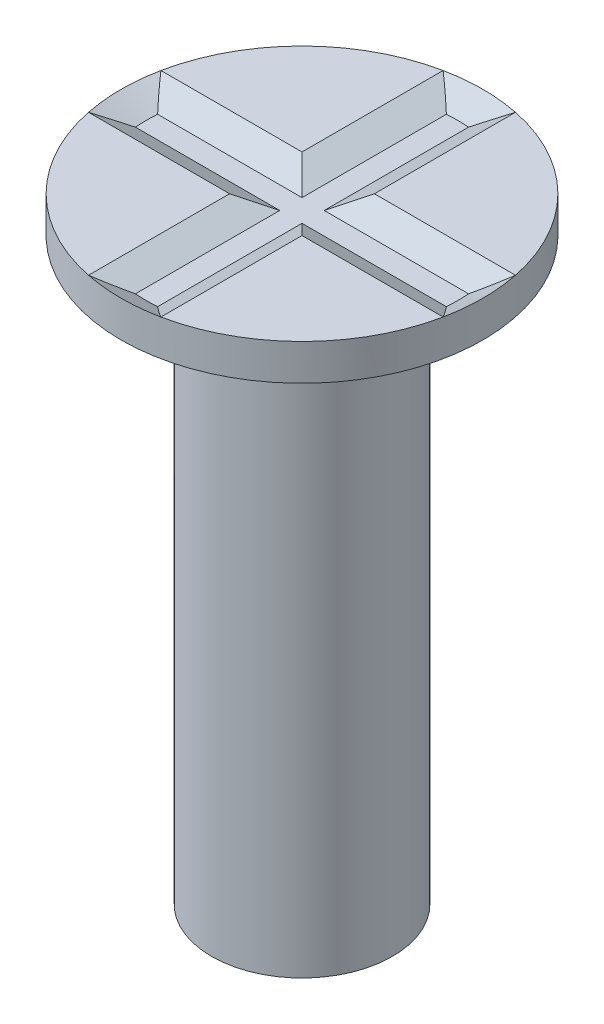
from build123d import *

# Parameters (mm, degrees)
SKETCH1_R           = 0.5
BOSS_EXTRUDE1_DEPTH = 0.1
BOSS_EXTRUDE2_START = -0.1
SKETCH1_3_R         = 0.25
BOSS_EXTRUDE2_DEPTH = 1.6
CUT_EXTRUDE1_DEPTH  = 0.04
CUT_EXTRUDE1_TAPER  = 60


with BuildPart() as part:
    # Sketch1 → Boss-Extrude1 (new body)
    with BuildSketch(Plane(origin=(0, 0, 0), x_dir=(1, 0, 0), z_dir=(0, 1, 0))):
        with Locations(Location((0, 0, 0), (0, 0, 270))):
            Circle(SKETCH1_R)
    extrude(amount=-BOSS_EXTRUDE1_DEPTH)

    # Sketch1<3> → Boss-Extrude2 (add)
    with BuildSketch(Plane(origin=(0, 0, 0), x_dir=(1, 0, 0), z_dir=(0, 1, 0)).offset(BOSS_EXTRUDE2_START)):
        with Locations(Location((0, 0, 0), (0, 0, 270))):
            Circle(SKETCH1_3_R)
    extrude(amount=-BOSS_EXTRUDE2_DEPTH)

    # Sketch2 → Cut-Extrude1 (cut)
    with BuildSketch(Plane(origin=(0, 0, 0), x_dir=(1, 0, 0), z_dir=(0, 1, 0))):
        with BuildLine():
            ThreePointArc((0.1, 0.489897949), (0, 0.5), (-0.1, 0.489897949))
            Line((-0.1, 0.489897949), (-0.1, 0.1))
            Line((-0.1, 0.1), (-0.489897949, 0.1))
            ThreePointArc((-0.489897949, 0.1), (-0.5, 0), (-0.489897949, -0.1))
            Line((-0.489897949, -0.1), (-0.1, -0.1))
            Line((-0.1, -0.1), (-0.1, -0.489897949))
            ThreePointArc((-0.1, -0.489897949), (0, -0.5), (0.1, -0.489897949))
            Line((0.1, -0.489897949), (0.1, -0.1))
            Line((0.1, -0.1), (0.489897949, -0.1))
            ThreePointArc((0.489897949, -0.1), (0.5, 0), (0.489897949, 0.1))
            Line((0.489897949, 0.1), (0.1, 0.1))
            Line((0.1, 0.1), (0.1, 0.489897949))
        make_face()
    extrude(amount=-CUT_EXTRUDE1_DEPTH, taper=CUT_EXTRUDE1_TAPER, mode=Mode.SUBTRACT)


solid = part.part
